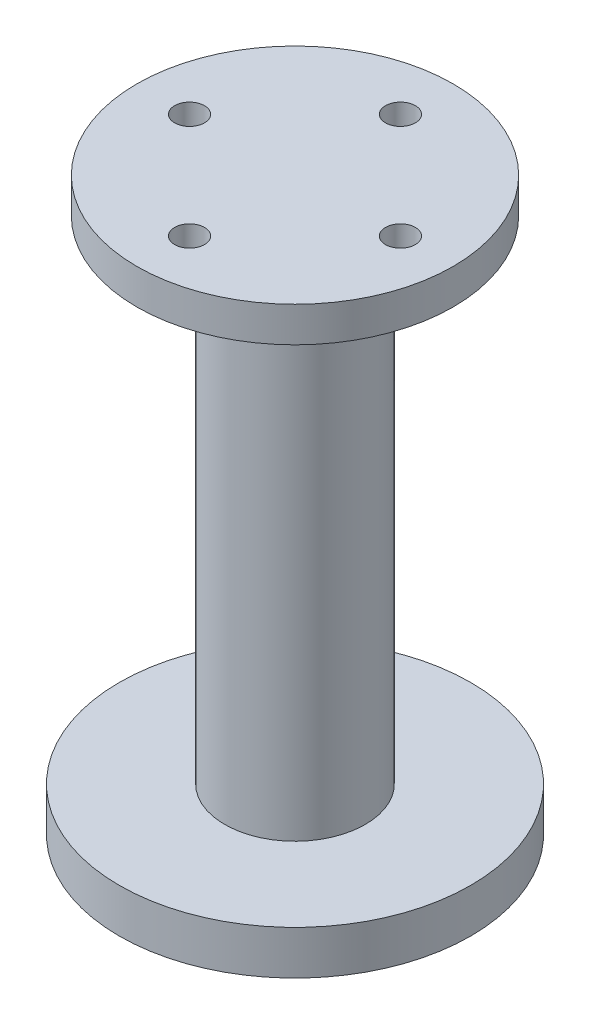
from build123d import *

# Parameters (mm, degrees)
SKETCH_2_R          = 1.7
CUT_EXTRUDE_1_DEPTH = 10


with BuildPart() as part:
    # 草图1 → 旋转1 (revolve)
    with BuildSketch(Plane.XY, mode=Mode.PRIVATE) as revolve_1_sk:
        Polygon((0, 0), (-20, 0), (-20, 5), (-8, 5), (-8, 61), (-18, 61), (-18, 65), (0, 65), align=None)
    revolve(revolve_1_sk.sketch.rotate(Axis((0, 0, 0), (0, 1, 0)), 270), axis=Axis((0, 0, 0), (0, 1, 0)))

    # 草图2 → 切除-拉伸1 (cut)
    with BuildSketch(Plane(origin=(0, 65, 0), x_dir=(1, 0, 0), z_dir=(0, 1, 0))):
        with Locations(Location((12, 0, 0), (0, 0, 270))):
            Circle(SKETCH_2_R)
        with Locations(Location((0, -12, 0), (0, 0, 270))):
            Circle(SKETCH_2_R)
        with Locations(Location((-12, 0, 0), (0, 0, 270))):
            Circle(SKETCH_2_R)
        with Locations(Location((0, 12, 0), (0, 0, 270))):
            Circle(SKETCH_2_R)
    extrude(amount=-CUT_EXTRUDE_1_DEPTH, mode=Mode.SUBTRACT)


solid = part.part
